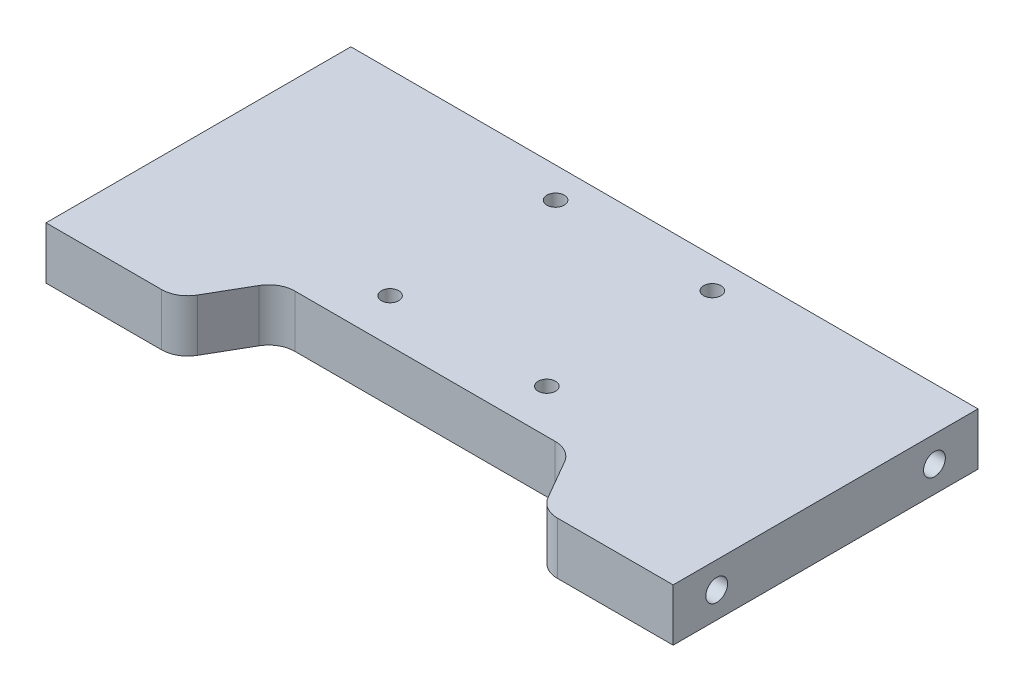
from build123d import *

# Parameters (mm, degrees)
SKETCH1_W                   = 72
SKETCH1_H                   = 35
BOSS_EXTRUDE1_DEPTH         = 6
CUT_EXTRUDE3_REACH          = 82.281
CUT_EXTRUDE4_REACH          = 82.281
SKETCH5_R                   = 1
FILLET1_R                   = 3
TAP_DRILL_FOR_M3_TAP1_D     = 2.5
TAP_DRILL_FOR_M3_TAP1_DEPTH = 10
TAP_DRILL_FOR_M3_TAP1_TIP   = 0.751075774
TAP_DRILL_FOR_M3_TAP2_D     = 2.5
TAP_DRILL_FOR_M3_TAP2_DEPTH = 10
TAP_DRILL_FOR_M3_TAP2_TIP   = 0.751075774


with BuildPart() as part:
    # Sketch1 → Boss-Extrude1 (new body)
    with BuildSketch(Plane(origin=(0, 0, 0), x_dir=(1, 0, 0), z_dir=(0, 1, 0))):
        with Locations((36, 17.5)):
            Rectangle(SKETCH1_W, SKETCH1_H)
    extrude(amount=BOSS_EXTRUDE1_DEPTH)

    # Sketch4 → Cut-Extrude3 (cut, up to next)
    with BuildSketch(Plane(origin=(0, 6, 0), x_dir=(1, 0, 0), z_dir=(0, 1, 0)), mode=Mode.PRIVATE) as cut_extrude3_sk1:
        Polygon((15, 0), (57, 0), (52.669872981, 7.5), (19.330127019, 7.5), align=None)
    cut_extrude3_tool1 = extrude(cut_extrude3_sk1.sketch, amount=-CUT_EXTRUDE3_REACH, mode=Mode.PRIVATE) & part.part
    add(cut_extrude3_tool1.solids().sort_by_distance((36, 6, -3.606313))[0], mode=Mode.SUBTRACT)

    # Sketch5 → Cut-Extrude4 (cut, up to next)
    with BuildSketch(Plane(origin=(0, 6, 0), x_dir=(1, 0, 0), z_dir=(0, 1, 0)), mode=Mode.PRIVATE) as cut_extrude4_sk1:
        with Locations(Location((27, 12.5, 0), (0, 0, 270))):
            Circle(SKETCH5_R)
    cut_extrude4_tool1 = extrude(cut_extrude4_sk1.sketch, amount=-CUT_EXTRUDE4_REACH, mode=Mode.PRIVATE) & part.part
    # Sketch5 → Cut-Extrude4 (cut, up to next)
    with BuildSketch(Plane(origin=(0, 6, 0), x_dir=(1, 0, 0), z_dir=(0, 1, 0)), mode=Mode.PRIVATE) as cut_extrude4_sk2:
        with Locations(Location((45, 12.5, 0), (0, 0, 270))):
            Circle(SKETCH5_R)
    cut_extrude4_tool2 = extrude(cut_extrude4_sk2.sketch, amount=-CUT_EXTRUDE4_REACH, mode=Mode.PRIVATE) & part.part
    # Sketch5 → Cut-Extrude4 (cut, up to next)
    with BuildSketch(Plane(origin=(0, 6, 0), x_dir=(1, 0, 0), z_dir=(0, 1, 0)), mode=Mode.PRIVATE) as cut_extrude4_sk3:
        with Locations(Location((45, 31.5, 0), (0, 0, 270))):
            Circle(SKETCH5_R)
    cut_extrude4_tool3 = extrude(cut_extrude4_sk3.sketch, amount=-CUT_EXTRUDE4_REACH, mode=Mode.PRIVATE) & part.part
    # Sketch5 → Cut-Extrude4 (cut, up to next)
    with BuildSketch(Plane(origin=(0, 6, 0), x_dir=(1, 0, 0), z_dir=(0, 1, 0)), mode=Mode.PRIVATE) as cut_extrude4_sk4:
        with Locations(Location((27, 31.5, 0), (0, 0, 270))):
            Circle(SKETCH5_R)
    cut_extrude4_tool4 = extrude(cut_extrude4_sk4.sketch, amount=-CUT_EXTRUDE4_REACH, mode=Mode.PRIVATE) & part.part
    add(cut_extrude4_tool1.solids().sort_by_distance((27, 6, -12.5))[0], mode=Mode.SUBTRACT)
    add(cut_extrude4_tool2.solids().sort_by_distance((45, 6, -12.5))[0], mode=Mode.SUBTRACT)
    add(cut_extrude4_tool3.solids().sort_by_distance((45, 6, -31.5))[0], mode=Mode.SUBTRACT)
    add(cut_extrude4_tool4.solids().sort_by_distance((27, 6, -31.5))[0], mode=Mode.SUBTRACT)

    # Fillet1
    fillet1_edges = [part.edges().sort_by_distance(p)[0] for p in [
        (15, 3, 0),
        (19.330127019, 3, -7.5),
        (52.669872981, 3, -7.5),
        (57, 3, 0),
    ]]
    fillet(fillet1_edges, radius=FILLET1_R)

    # Tap Drill for M3 Tap1
    with Locations(Plane.ZY):
        with Locations((-30, 3), (-5, 3)):
            Hole(TAP_DRILL_FOR_M3_TAP1_D / 2, depth=TAP_DRILL_FOR_M3_TAP1_DEPTH)
            with Locations((0, 0, -(TAP_DRILL_FOR_M3_TAP1_DEPTH + TAP_DRILL_FOR_M3_TAP1_TIP / 2))):  # 118° drill point
                Cone(0, TAP_DRILL_FOR_M3_TAP1_D / 2, TAP_DRILL_FOR_M3_TAP1_TIP, mode=Mode.SUBTRACT)

    # Tap Drill for M3 Tap2
    with Locations(Plane(origin=(72, 0, 0), x_dir=(0, 0, -1), z_dir=(1, 0, 0))):
        with Locations((5, 3), (30, 3)):
            Hole(TAP_DRILL_FOR_M3_TAP2_D / 2, depth=TAP_DRILL_FOR_M3_TAP2_DEPTH)
            with Locations((0, 0, -(TAP_DRILL_FOR_M3_TAP2_DEPTH + TAP_DRILL_FOR_M3_TAP2_TIP / 2))):  # 118° drill point
                Cone(0, TAP_DRILL_FOR_M3_TAP2_D / 2, TAP_DRILL_FOR_M3_TAP2_TIP, mode=Mode.SUBTRACT)


solid = part.part
